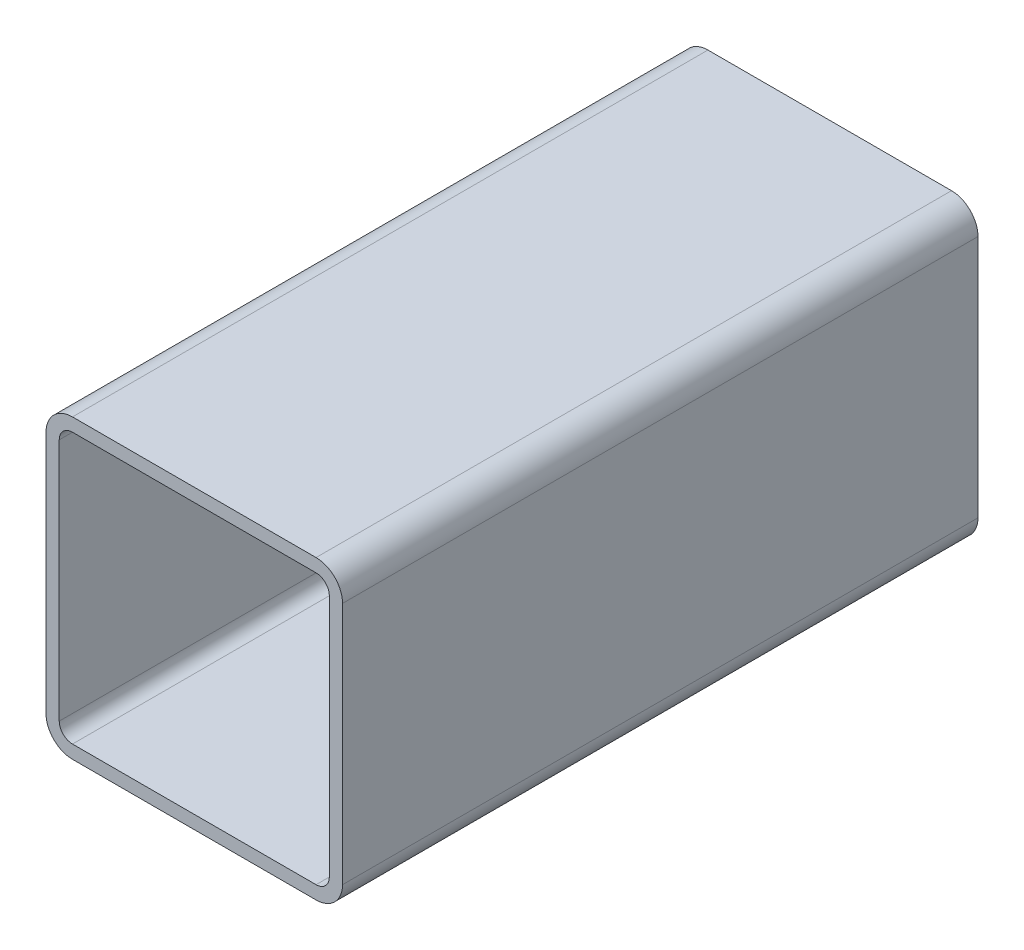
from build123d import *

# Parameters (mm, degrees)
BOSS_EXTRUDE1_DEPTH = 2070.1
SKETCH2_R           = 6.35
CUT_EXTRUDE1_DEPTH  = 2073.54194621
SKETCH3_R           = 3.274297192
CUT_EXTRUDE2_DEPTH  = 2073.54194621
CUT_EXTRUDE3_REACH  = 2074.542
SKETCH4_R           = 1.905
CUT_EXTRUDE4_DEPTH  = 1917.7


with BuildPart() as part:
    # Sketch1 → Boss-Extrude1 (new body)
    with BuildSketch(Plane.XY):
        with BuildLine():
            Line((6.35, 0), (64.77, 0))
            ThreePointArc((64.77, 0), (69.260128061, 1.859871939), (71.12, 6.35))
            Line((71.12, 6.35), (71.12, 64.77))
            ThreePointArc((71.12, 64.77), (69.260128061, 69.260128061), (64.77, 71.12))
            Line((64.77, 71.12), (6.35, 71.12))
            ThreePointArc((6.35, 71.12), (1.859871939, 69.260128061), (0, 64.77))
            Line((0, 64.77), (0, 6.35))
            ThreePointArc((0, 6.35), (1.859871939, 1.859871939), (6.35, 0))
        make_face()
        with BuildLine():
            Line((6.35, 3.175), (64.77, 3.175))
            ThreePointArc((64.77, 3.175), (67.01506403, 4.10493597), (67.945, 6.35))
            Line((67.945, 6.35), (67.945, 64.77))
            ThreePointArc((67.945, 64.77), (67.01506403, 67.01506403), (64.77, 67.945))
            Line((64.77, 67.945), (6.35, 67.945))
            ThreePointArc((6.35, 67.945), (4.10493597, 67.01506403), (3.175, 64.77))
            Line((3.175, 64.77), (3.175, 6.35))
            ThreePointArc((3.175, 6.35), (4.10493597, 4.10493597), (6.35, 3.175))
        make_face(mode=Mode.SUBTRACT)
    extrude(amount=BOSS_EXTRUDE1_DEPTH)

    # Sketch2 → Cut-Extrude1 (cut, through all)
    with BuildSketch(Plane(origin=(0, 0, 0), x_dir=(1, 0, 0), z_dir=(0, 1, 0))):
        with Locations(Location((35.56, -101.6, 0), (0, 0, 90))):
            Circle(SKETCH2_R)
        with Locations(Location((35.56, -279.4, 0), (0, 0, 90))):
            Circle(SKETCH2_R)
    extrude(amount=CUT_EXTRUDE1_DEPTH, mode=Mode.SUBTRACT)

    # Sketch3 → Cut-Extrude2 (cut, through all)
    with BuildSketch(Plane.ZY):
        with Locations((12.7, 53.975)):
            Circle(SKETCH3_R)
        with Locations((12.7, 17.145)):
            Circle(SKETCH3_R)
        with Locations((63.5, 17.145)):
            Circle(SKETCH3_R)
        with Locations((63.5, 53.975)):
            Circle(SKETCH3_R)
    extrude(amount=-CUT_EXTRUDE2_DEPTH, mode=Mode.SUBTRACT)

    # Sketch4 → Cut-Extrude3 (cut, up to next)
    with BuildSketch(Plane(origin=(0, 71.12, 0), x_dir=(1, 0, 0), z_dir=(0, 1, 0)), mode=Mode.PRIVATE) as cut_extrude3_sk1:
        with Locations(Location((13.335, -1508.125, 0), (0, 0, 270))):
            Circle(SKETCH4_R)
    cut_extrude3_tool1 = extrude(cut_extrude3_sk1.sketch, amount=-CUT_EXTRUDE3_REACH, mode=Mode.PRIVATE) & part.part
    # Sketch4 → Cut-Extrude3 (cut, up to next)
    with BuildSketch(Plane(origin=(0, 71.12, 0), x_dir=(1, 0, 0), z_dir=(0, 1, 0)), mode=Mode.PRIVATE) as cut_extrude3_sk2:
        with Locations(Location((57.785, -1508.125, 0), (0, 0, 270))):
            Circle(SKETCH4_R)
    cut_extrude3_tool2 = extrude(cut_extrude3_sk2.sketch, amount=-CUT_EXTRUDE3_REACH, mode=Mode.PRIVATE) & part.part
    # Sketch4 → Cut-Extrude3 (cut, up to next)
    with BuildSketch(Plane(origin=(0, 71.12, 0), x_dir=(1, 0, 0), z_dir=(0, 1, 0)), mode=Mode.PRIVATE) as cut_extrude3_sk3:
        with Locations(Location((57.785, -1565.275, 0), (0, 0, 270))):
            Circle(SKETCH4_R)
    cut_extrude3_tool3 = extrude(cut_extrude3_sk3.sketch, amount=-CUT_EXTRUDE3_REACH, mode=Mode.PRIVATE) & part.part
    # Sketch4 → Cut-Extrude3 (cut, up to next)
    with BuildSketch(Plane(origin=(0, 71.12, 0), x_dir=(1, 0, 0), z_dir=(0, 1, 0)), mode=Mode.PRIVATE) as cut_extrude3_sk4:
        with Locations(Location((13.335, -1565.275, 0), (0, 0, 270))):
            Circle(SKETCH4_R)
    cut_extrude3_tool4 = extrude(cut_extrude3_sk4.sketch, amount=-CUT_EXTRUDE3_REACH, mode=Mode.PRIVATE) & part.part
    # Sketch4 → Cut-Extrude3 (cut, up to next)
    with BuildSketch(Plane(origin=(0, 71.12, 0), x_dir=(1, 0, 0), z_dir=(0, 1, 0)), mode=Mode.PRIVATE) as cut_extrude3_sk5:
        with Locations(Location((13.335, -1133.475, 0), (0, 0, 270))):
            Circle(SKETCH4_R)
    cut_extrude3_tool5 = extrude(cut_extrude3_sk5.sketch, amount=-CUT_EXTRUDE3_REACH, mode=Mode.PRIVATE) & part.part
    # Sketch4 → Cut-Extrude3 (cut, up to next)
    with BuildSketch(Plane(origin=(0, 71.12, 0), x_dir=(1, 0, 0), z_dir=(0, 1, 0)), mode=Mode.PRIVATE) as cut_extrude3_sk6:
        with Locations(Location((57.785, -1133.475, 0), (0, 0, 270))):
            Circle(SKETCH4_R)
    cut_extrude3_tool6 = extrude(cut_extrude3_sk6.sketch, amount=-CUT_EXTRUDE3_REACH, mode=Mode.PRIVATE) & part.part
    # Sketch4 → Cut-Extrude3 (cut, up to next)
    with BuildSketch(Plane(origin=(0, 71.12, 0), x_dir=(1, 0, 0), z_dir=(0, 1, 0)), mode=Mode.PRIVATE) as cut_extrude3_sk7:
        with Locations(Location((57.785, -1190.625, 0), (0, 0, 270))):
            Circle(SKETCH4_R)
    cut_extrude3_tool7 = extrude(cut_extrude3_sk7.sketch, amount=-CUT_EXTRUDE3_REACH, mode=Mode.PRIVATE) & part.part
    # Sketch4 → Cut-Extrude3 (cut, up to next)
    with BuildSketch(Plane(origin=(0, 71.12, 0), x_dir=(1, 0, 0), z_dir=(0, 1, 0)), mode=Mode.PRIVATE) as cut_extrude3_sk8:
        with Locations(Location((13.335, -1190.625, 0), (0, 0, 270))):
            Circle(SKETCH4_R)
    cut_extrude3_tool8 = extrude(cut_extrude3_sk8.sketch, amount=-CUT_EXTRUDE3_REACH, mode=Mode.PRIVATE) & part.part
    add(cut_extrude3_tool1.solids().sort_by_distance((13.335, 71.12, 1508.125))[0], mode=Mode.SUBTRACT)
    add(cut_extrude3_tool2.solids().sort_by_distance((57.785, 71.12, 1508.125))[0], mode=Mode.SUBTRACT)
    add(cut_extrude3_tool3.solids().sort_by_distance((57.785, 71.12, 1565.275))[0], mode=Mode.SUBTRACT)
    add(cut_extrude3_tool4.solids().sort_by_distance((13.335, 71.12, 1565.275))[0], mode=Mode.SUBTRACT)
    add(cut_extrude3_tool5.solids().sort_by_distance((13.335, 71.12, 1133.475))[0], mode=Mode.SUBTRACT)
    add(cut_extrude3_tool6.solids().sort_by_distance((57.785, 71.12, 1133.475))[0], mode=Mode.SUBTRACT)
    add(cut_extrude3_tool7.solids().sort_by_distance((57.785, 71.12, 1190.625))[0], mode=Mode.SUBTRACT)
    add(cut_extrude3_tool8.solids().sort_by_distance((13.335, 71.12, 1190.625))[0], mode=Mode.SUBTRACT)

    # Sketch5 → Cut-Extrude4 (cut)
    with BuildSketch(Plane(origin=(0, 0, 0), x_dir=(-1, 0, 0), z_dir=(0, 0, -1))):
        with BuildLine():
            Line((0, 6.35), (0, 64.77))
            ThreePointArc((0, 64.77), (-1.859871939, 69.260128061), (-6.35, 71.12))
            Line((-6.35, 71.12), (-64.77, 71.12))
            ThreePointArc((-64.77, 71.12), (-69.260128061, 69.260128061), (-71.12, 64.77))
            Line((-71.12, 64.77), (-71.12, 6.35))
            ThreePointArc((-71.12, 6.35), (-69.260128061, 1.859871939), (-64.77, 0))
            Line((-64.77, 0), (-6.35, 0))
            ThreePointArc((-6.35, 0), (-1.859871939, 1.859871939), (0, 6.35))
        make_face()
    extrude(amount=-CUT_EXTRUDE4_DEPTH, mode=Mode.SUBTRACT)


solid = part.part
